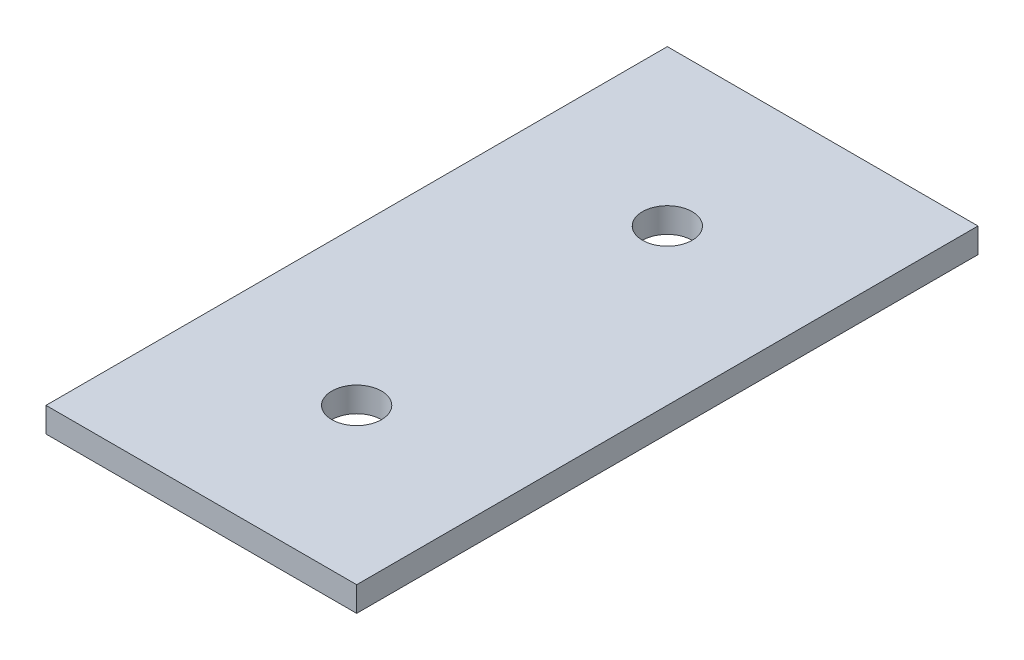
from build123d import *

# Parameters (mm, degrees)
SKETCH1_W           = 50
SKETCH1_H           = 100
BOSS_EXTRUDE1_DEPTH = 4
SKETCH2_R           = 4
CUT_EXTRUDE1_DEPTH  = 112.874930168


with BuildPart() as part:
    # Sketch1 → Boss-Extrude1 (new body)
    with BuildSketch(Plane(origin=(0, 0, 0), x_dir=(1, 0, 0), z_dir=(0, 1, 0))):
        with Locations((25, 50)):
            Rectangle(SKETCH1_W, SKETCH1_H)
    extrude(amount=BOSS_EXTRUDE1_DEPTH)

    # Sketch2 → Cut-Extrude1 (cut, through all)
    with BuildSketch(Plane(origin=(0, 4, 0), x_dir=(1, 0, 0), z_dir=(0, 1, 0))):
        with Locations(Location((25, 75, 0), (0, 0, 270))):
            Circle(SKETCH2_R)
        with Locations(Location((25, 25, 0), (0, 0, 270))):
            Circle(SKETCH2_R)
    extrude(amount=-CUT_EXTRUDE1_DEPTH, mode=Mode.SUBTRACT)


solid = part.part
